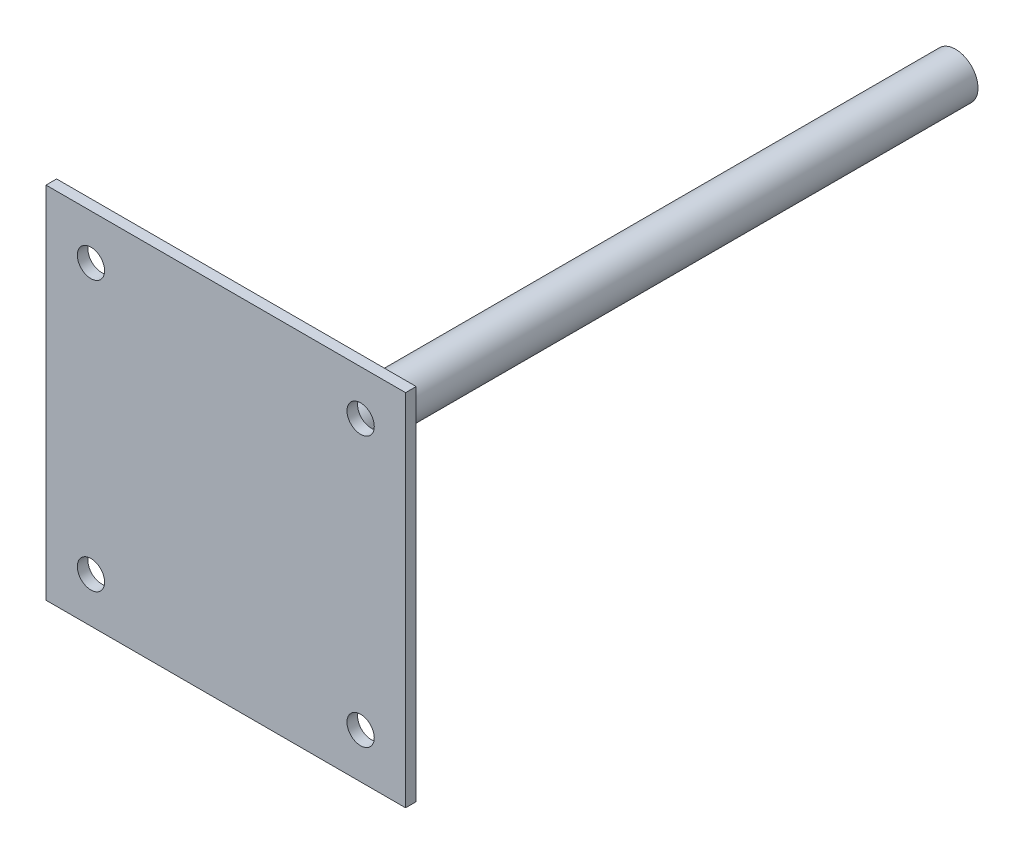
from build123d import *

# Parameters (mm, degrees)
SKETCH1_W           = 101.6
SKETCH1_H           = 101.6
SKETCH1_R           = 3.856433765
BOSS_EXTRUDE1_DEPTH = 3
SKETCH1_4_R         = 6.35
BOSS_EXTRUDE2_DEPTH = 203.2


with BuildPart() as part:
    # Sketch1 → Boss-Extrude1 (new body)
    with BuildSketch(Plane.XY):
        Rectangle(SKETCH1_W, SKETCH1_H)
        with Locations((-38.1, -38.1)):
            Circle(SKETCH1_R, mode=Mode.SUBTRACT)
        with Locations((38.1, -38.1)):
            Circle(SKETCH1_R, mode=Mode.SUBTRACT)
        with Locations((-38.1, 38.1)):
            Circle(SKETCH1_R, mode=Mode.SUBTRACT)
        with Locations((38.1, 38.1)):
            Circle(SKETCH1_R, mode=Mode.SUBTRACT)
    extrude(amount=BOSS_EXTRUDE1_DEPTH)

    # Sketch1<4> → Boss-Extrude2 (add)
    with BuildSketch(Plane.XY):
        Circle(SKETCH1_4_R)
    extrude(amount=-BOSS_EXTRUDE2_DEPTH)


solid = part.part
